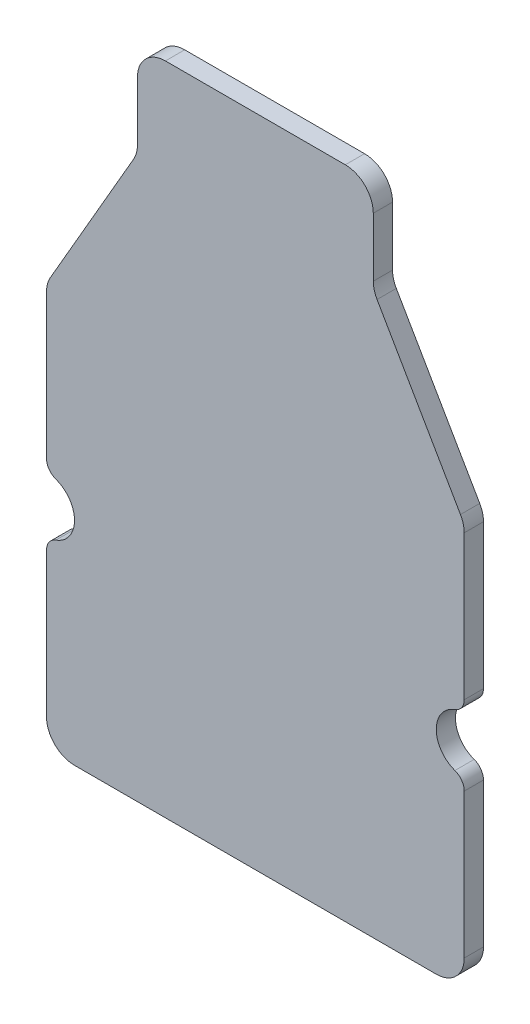
from build123d import *

# Parameters (mm, degrees)
BOSS_EXTRUDE1_DEPTH = 6.88
FILLET1_R           = 10
SKETCH2_R           = 10
CUT_EXTRUDE1_DEPTH  = 179.640923083
FILLET2_R           = 5


with BuildPart() as part:
    # Sketch1 → Boss-Extrude1 (new body)
    with BuildSketch(Plane.XY):
        Polygon((-74.65, 72.15), (-42.15, 128.441651246), (-42.15, 162.15), (-22.688475773, 162.15), (22.688475773, 162.15), (42.15, 162.15), (42.15, 128.441651246), (74.65, 72.15), (74.65, -72.15), (-74.65, -72.15), align=None)
    extrude(amount=BOSS_EXTRUDE1_DEPTH)

    # Fillet1
    fillet1_edges = [part.edges().sort_by_distance(p)[0] for p in [
        (-74.65, 72.15, 3.44),
        (-42.15, 128.441651246, 3.44),
        (-42.15, 162.15, 3.44),
        (42.15, 162.15, 3.44),
        (42.15, 128.441651246, 3.44),
        (74.65, 72.15, 3.44),
        (74.65, -72.15, 3.44),
        (-74.65, -72.15, 3.44),
    ]]
    fillet(fillet1_edges, radius=FILLET1_R)

    # Sketch2 → Cut-Extrude1 (cut, through all)
    with BuildSketch(Plane.XY.offset(6.88)):
        with Locations((-74.65, 3.660254038)):
            Circle(SKETCH2_R)
        with Locations((74.65, 3.660254038)):
            Circle(SKETCH2_R)
    extrude(amount=-CUT_EXTRUDE1_DEPTH, mode=Mode.SUBTRACT)

    # Fillet2
    fillet2_edges = [part.edges().sort_by_distance(p)[0] for p in [
        (-74.65, 13.660254038, 3.44),
        (-74.65, -6.339745962, 3.44),
        (74.65, -6.339745962, 3.44),
        (74.65, 13.660254038, 3.44),
    ]]
    fillet(fillet2_edges, radius=FILLET2_R)


solid = part.part
